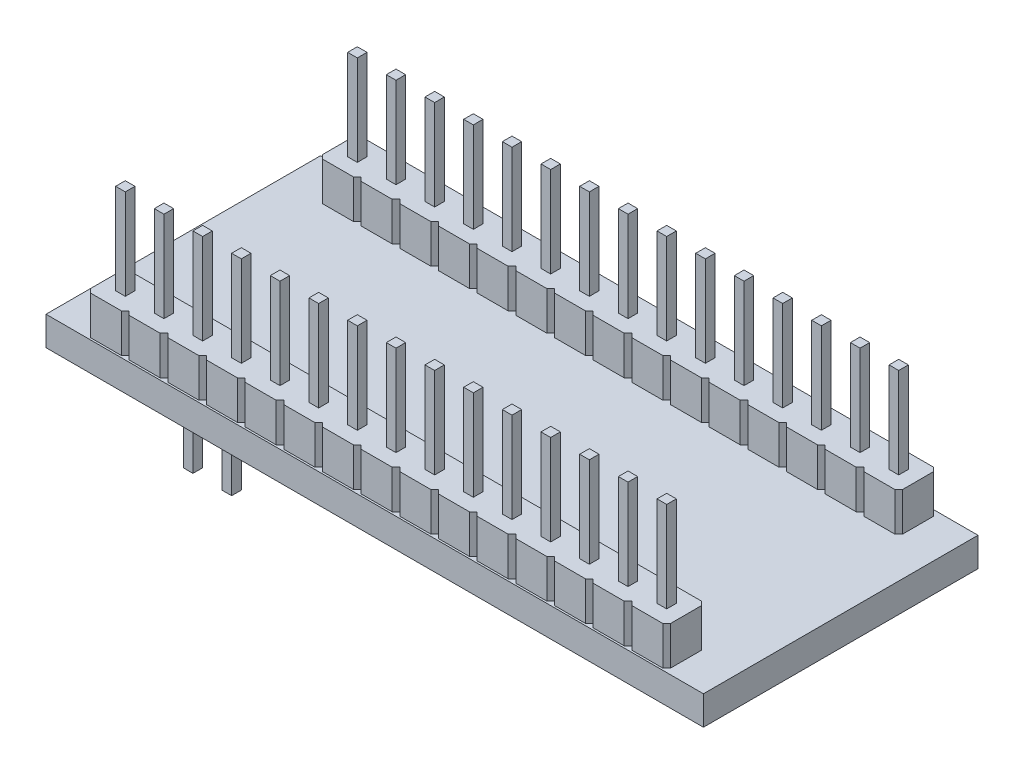
from build123d import *

# Parameters (mm, degrees)
BOSS_EXTRUDE1_DEPTH   = 2.54
BOSS_EXTRUDE1_2_DEPTH = 2.54
SKETCH2_W             = 43.18
SKETCH2_H             = 18.034
BOSS_EXTRUDE2_DEPTH   = 1.905
SKETCH3_W             = 0.635
SKETCH3_H             = 0.635
BOSS_EXTRUDE3_DEPTH   = 5.9436
BOSS_EXTRUDE4_DEPTH   = 0.635
BOSS_EXTRUDE5_DEPTH   = 2.54
SKETCH6_W             = 0.635
SKETCH6_H             = 0.635
BOSS_EXTRUDE6_DEPTH   = 5.9436


with BuildPart() as part:
    # Sketch1 → Boss-Extrude1 (new body)
    with BuildSketch(Plane(origin=(0, 0, 0), x_dir=(1, 0, 0), z_dir=(0, 1, 0))):
        Polygon((-16.764, 8.89), (-18.796, 8.89), (-19.05, 8.636), (-19.05, 6.604), (-18.796, 6.35), (-16.764, 6.35), (-16.51, 6.604), (-16.256, 6.35), (-14.224, 6.35), (-13.97, 6.604), (-13.716, 6.35), (-11.684, 6.35), (-11.43, 6.604), (-11.176, 6.35), (-9.144, 6.35), (-8.89, 6.604), (-8.636, 6.35), (-6.604, 6.35), (-6.35, 6.604), (-6.096, 6.35), (-4.064, 6.35), (-3.81, 6.604), (-3.556, 6.35), (-1.524, 6.35), (-1.27, 6.604), (-1.016, 6.35), (1.016, 6.35), (1.27, 6.604), (1.524, 6.35), (3.556, 6.35), (3.81, 6.604), (4.064, 6.35), (6.096, 6.35), (6.35, 6.604), (6.604, 6.35), (8.636, 6.35), (8.89, 6.604), (9.144, 6.35), (11.176, 6.35), (11.43, 6.604), (11.684, 6.35), (13.716, 6.35), (13.97, 6.604), (14.224, 6.35), (16.256, 6.35), (16.51, 6.604), (16.764, 6.35), (18.796, 6.35), (19.05, 6.604), (19.05, 8.636), (18.796, 8.89), (16.764, 8.89), (16.51, 8.636), (16.256, 8.89), (14.224, 8.89), (13.97, 8.636), (13.716, 8.89), (11.684, 8.89), (11.43, 8.636), (11.176, 8.89), (9.144, 8.89), (8.89, 8.636), (8.636, 8.89), (6.604, 8.89), (6.35, 8.636), (6.096, 8.89), (4.064, 8.89), (3.81, 8.636), (3.556, 8.89), (1.524, 8.89), (1.27, 8.636), (1.016, 8.89), (-1.016, 8.89), (-1.27, 8.636), (-1.524, 8.89), (-3.556, 8.89), (-3.81, 8.636), (-4.064, 8.89), (-6.096, 8.89), (-6.35, 8.636), (-6.604, 8.89), (-8.636, 8.89), (-8.89, 8.636), (-9.144, 8.89), (-11.176, 8.89), (-11.43, 8.636), (-11.684, 8.89), (-13.716, 8.89), (-13.97, 8.636), (-14.224, 8.89), (-16.256, 8.89), (-16.51, 8.636), align=None)
    extrude(amount=BOSS_EXTRUDE1_DEPTH)



with BuildPart() as body_2:
    # Sketch1 → Boss-Extrude1 2 (new body)
    with BuildSketch(Plane(origin=(0, 0, 0), x_dir=(1, 0, 0), z_dir=(0, 1, 0))):
        Polygon((-19.05, -8.636), (-18.796, -8.89), (-16.764, -8.89), (-16.51, -8.636), (-16.256, -8.89), (-14.224, -8.89), (-13.97, -8.636), (-13.716, -8.89), (-11.684, -8.89), (-11.43, -8.636), (-11.176, -8.89), (-9.144, -8.89), (-8.89, -8.636), (-8.636, -8.89), (-6.604, -8.89), (-6.35, -8.636), (-6.096, -8.89), (-4.064, -8.89), (-3.81, -8.636), (-3.556, -8.89), (-1.524, -8.89), (-1.27, -8.636), (-1.016, -8.89), (1.016, -8.89), (1.27, -8.636), (1.524, -8.89), (3.556, -8.89), (3.81, -8.636), (4.064, -8.89), (6.096, -8.89), (6.35, -8.636), (6.604, -8.89), (8.636, -8.89), (8.89, -8.636), (9.144, -8.89), (11.176, -8.89), (11.43, -8.636), (11.684, -8.89), (13.716, -8.89), (13.97, -8.636), (14.224, -8.89), (16.256, -8.89), (16.51, -8.636), (16.764, -8.89), (18.796, -8.89), (19.05, -8.636), (19.05, -6.604), (18.796, -6.35), (16.764, -6.35), (16.51, -6.604), (16.256, -6.35), (14.224, -6.35), (13.97, -6.604), (13.716, -6.35), (11.684, -6.35), (11.43, -6.604), (11.176, -6.35), (9.144, -6.35), (8.89, -6.604), (8.636, -6.35), (6.604, -6.35), (6.35, -6.604), (6.096, -6.35), (4.064, -6.35), (3.81, -6.604), (3.556, -6.35), (1.524, -6.35), (1.27, -6.604), (1.016, -6.35), (-1.016, -6.35), (-1.27, -6.604), (-1.524, -6.35), (-3.556, -6.35), (-3.81, -6.604), (-4.064, -6.35), (-6.096, -6.35), (-6.35, -6.604), (-6.604, -6.35), (-8.636, -6.35), (-8.89, -6.604), (-9.144, -6.35), (-11.176, -6.35), (-11.43, -6.604), (-11.684, -6.35), (-13.716, -6.35), (-13.97, -6.604), (-14.224, -6.35), (-16.256, -6.35), (-16.51, -6.604), (-16.764, -6.35), (-18.796, -6.35), (-19.05, -6.604), align=None)
    extrude(amount=BOSS_EXTRUDE1_2_DEPTH)


with BuildPart() as part_1:
    add(part.part)

    add(body_2.part)  # Boss-Extrude2 merges body 2
    # Sketch2 → Boss-Extrude2 (add)
    with BuildSketch(Plane.XZ):
        Rectangle(SKETCH2_W, SKETCH2_H)
    extrude(amount=BOSS_EXTRUDE2_DEPTH)

    # Sketch3 → Boss-Extrude3 (add)
    with BuildSketch(Plane(origin=(0, 2.54, 0), x_dir=(1, 0, 0), z_dir=(0, 1, 0))):
        with Locations((-15.24, 7.62)):
            Rectangle(SKETCH3_W, SKETCH3_H)
        with Locations((-17.78, 7.62)):
            Rectangle(SKETCH3_W, SKETCH3_H)
        with Locations((-12.7, 7.62)):
            Rectangle(SKETCH3_W, SKETCH3_H)
        with Locations((-10.16, 7.62)):
            Rectangle(SKETCH3_W, SKETCH3_H)
        with Locations((-7.62, 7.62)):
            Rectangle(SKETCH3_W, SKETCH3_H)
        with Locations((-5.08, 7.62)):
            Rectangle(SKETCH3_W, SKETCH3_H)
        with Locations((-2.54, 7.62)):
            Rectangle(SKETCH3_W, SKETCH3_H)
        with Locations((0, 7.62)):
            Rectangle(SKETCH3_W, SKETCH3_H)
        with Locations((2.54, 7.62)):
            Rectangle(SKETCH3_W, SKETCH3_H)
        with Locations((5.08, 7.62)):
            Rectangle(SKETCH3_W, SKETCH3_H)
        with Locations((7.62, 7.62)):
            Rectangle(SKETCH3_W, SKETCH3_H)
        with Locations((10.16, 7.62)):
            Rectangle(SKETCH3_W, SKETCH3_H)
        with Locations((12.7, 7.62)):
            Rectangle(SKETCH3_W, SKETCH3_H)
        with Locations((15.24, 7.62)):
            Rectangle(SKETCH3_W, SKETCH3_H)
        with Locations((17.78, 7.62)):
            Rectangle(SKETCH3_W, SKETCH3_H)
        with Locations((-15.24, -7.62)):
            Rectangle(SKETCH3_W, SKETCH3_H)
        with Locations((-12.7, -7.62)):
            Rectangle(SKETCH3_W, SKETCH3_H)
        with Locations((-10.16, -7.62)):
            Rectangle(SKETCH3_W, SKETCH3_H)
        with Locations((-7.62, -7.62)):
            Rectangle(SKETCH3_W, SKETCH3_H)
        with Locations((-5.08, -7.62)):
            Rectangle(SKETCH3_W, SKETCH3_H)
        with Locations((-2.54, -7.62)):
            Rectangle(SKETCH3_W, SKETCH3_H)
        with Locations((0, -7.62)):
            Rectangle(SKETCH3_W, SKETCH3_H)
        with Locations((2.54, -7.62)):
            Rectangle(SKETCH3_W, SKETCH3_H)
        with Locations((5.08, -7.62)):
            Rectangle(SKETCH3_W, SKETCH3_H)
        with Locations((7.62, -7.62)):
            Rectangle(SKETCH3_W, SKETCH3_H)
        with Locations((10.16, -7.62)):
            Rectangle(SKETCH3_W, SKETCH3_H)
        with Locations((12.7, -7.62)):
            Rectangle(SKETCH3_W, SKETCH3_H)
        with Locations((15.24, -7.62)):
            Rectangle(SKETCH3_W, SKETCH3_H)
        with Locations((17.78, -7.62)):
            Rectangle(SKETCH3_W, SKETCH3_H)
        with Locations((-17.78, -7.62)):
            Rectangle(SKETCH3_W, SKETCH3_H)
    extrude(amount=BOSS_EXTRUDE3_DEPTH)

    # Sketch4 → Boss-Extrude4 (add)
    with BuildSketch(Plane.XZ.offset(1.905)):
        Polygon((0, 0), (4.490128061, 4.490128061), (8.971390959, 0.008865162), (4.481262899, -4.481262899), align=None)
    extrude(amount=BOSS_EXTRUDE4_DEPTH)

    # Sketch5 → Boss-Extrude5 (add)
    with BuildSketch(Plane.XZ.offset(1.905)):
        Polygon((-14.605, -1.524), (-14.859, -1.27), (-14.605, -1.016), (-14.605, 1.016), (-14.859, 1.27), (-14.605, 1.524), (-14.605, 3.556), (-14.859, 3.81), (-16.891, 3.81), (-17.145, 3.556), (-17.399, 3.81), (-19.431, 3.81), (-19.685, 3.556), (-19.685, 1.524), (-19.431, 1.27), (-19.685, 1.016), (-19.685, -1.016), (-19.431, -1.27), (-19.685, -1.524), (-19.685, -3.556), (-19.431, -3.81), (-17.399, -3.81), (-17.145, -3.556), (-16.891, -3.81), (-14.859, -3.81), (-14.605, -3.556), align=None)
        Polygon((-16.891, -1.27), (-17.145, -1.524), (-17.399, -1.27), (-17.145, -1.016), align=None, mode=Mode.SUBTRACT)
        Polygon((-16.891, 1.27), (-17.145, 1.016), (-17.399, 1.27), (-17.145, 1.524), align=None, mode=Mode.SUBTRACT)
    extrude(amount=BOSS_EXTRUDE5_DEPTH)

    # Sketch6 → Boss-Extrude6 (add)
    with BuildSketch(Plane.XZ.offset(4.445)):
        with Locations((-15.875, -2.54)):
            Rectangle(SKETCH6_W, SKETCH6_H)
        with Locations((-18.415, -2.54)):
            Rectangle(SKETCH6_W, SKETCH6_H)
        with Locations((-15.875, 0)):
            Rectangle(SKETCH6_W, SKETCH6_H)
        with Locations((-15.875, 2.54)):
            Rectangle(SKETCH6_W, SKETCH6_H)
        with Locations((-18.415, 0)):
            Rectangle(SKETCH6_W, SKETCH6_H)
        with Locations((-18.415, 2.54)):
            Rectangle(SKETCH6_W, SKETCH6_H)
    extrude(amount=BOSS_EXTRUDE6_DEPTH)


solid = part_1.part
